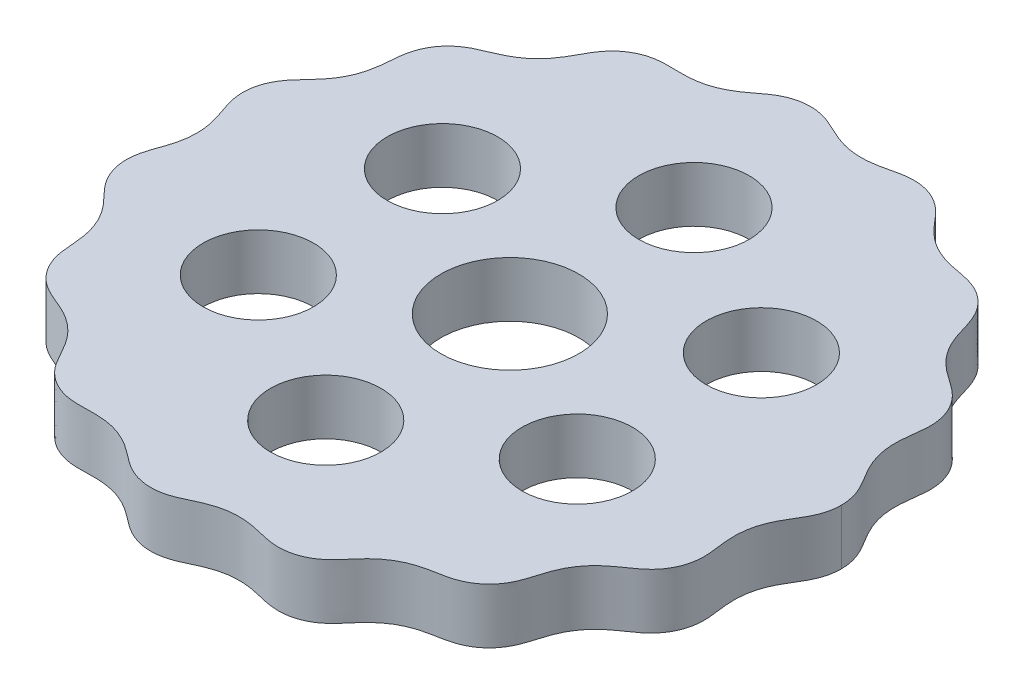
from build123d import *

# Parameters (mm, degrees)
BOSS_EXTRUDE1_DEPTH = 6
SKETCH4_R           = 7.5
SKETCH4_R_2         = 6
CUT_EXTRUDE1_DEPTH  = 52.384193919


with BuildPart() as part:
    # Sketch3 → Boss-Extrude1 (new body)
    with BuildSketch(Plane(origin=(0, 0, 0), x_dir=(1, 0, 0), z_dir=(0, 1, 0))):
        with BuildLine():
            add(Edge.make_bspline(
                [(-35, 0), (-35, -0.035819522), (-35.000616373, -0.107462841), (-35.003390054, -0.256808001), (-35.01077535, -0.421646413), (-35.021825769, -0.588219856), (-35.036504882, -0.756672424), (-35.059341773, -0.965837166), (-35.104035951, -1.290553755), (-35.185204177, -1.728353622), (-35.321111932, -2.274340703), (-35.511398877, -2.882930915), (-35.744117036, -3.541888991), (-35.999231193, -4.25800942), (-36.256031973, -5.161379022), (-36.390330129, -6.274752326), (-36.277015947, -7.512136969), (-35.868698722, -8.695231313), (-35.277300884, -9.669426211), (-34.554347705, -10.519941998), (-33.783626013, -11.298902855), (-32.985846748, -12.201646947), (-32.264584631, -13.30297659), (-31.737724515, -14.528623762), (-31.426244596, -15.845428611), (-31.299137645, -17.27258243), (-31.216127, -18.70530298), (-30.816120234, -20.100603953), (-30.073240875, -21.341751418), (-29.174351138, -22.250438515), (-28.172415899, -22.896093055), (-27.127590318, -23.355931746), (-26.10859664, -23.758738206), (-25.049780962, -24.277964858), (-23.989709649, -24.997868072), (-23.038745697, -25.922173331), (-22.234852767, -27.03288543), (-21.57001817, -28.281907032), (-20.900127092, -29.513378936), (-19.962466181, -30.574068753), (-18.795181919, -31.366318649), (-17.595631263, -31.810691732), (-16.414666993, -31.974330851), (-15.281171148, -31.958959306), (-14.203514384, -31.91747762), (-13.042151806, -31.968001953), (-11.783279681, -32.201214224), (-10.531309832, -32.66971044), (-9.48395263, -33.292502605), (-8.648334169, -33.920550223), (-7.823957174, -34.560196788), (-6.963270269, -35.155080008), (-5.844676613, -35.655024643), (-4.471519425, -35.893755086), (-3.187084678, -35.805499477), (-2.025952576, -35.461710054), (-0.992256939, -34.976213141), (-0.022683462, -34.502923006), (1.053080375, -34.087641485), (2.299584809, -33.794526859), (3.643320491, -33.722351619), (5.038534255, -33.89893647), (6.24598376, -34.2125404), (7.264354515, -34.444119372), (8.305207807, -34.543324073), (9.35208771, -34.482213909), (10.516758731, -34.167289325), (11.659268337, -33.537177777), (12.590715473, -32.709121516), (13.34098787, -31.814858509), (14.054283468, -30.982389039), (14.885038409, -30.182951686), (15.921872801, -29.431794231), (16.990420846, -28.917750141), (18.026343297, -28.602305782), (18.918007091, -28.413618025), (19.578784746, -28.293993849), (20.403759493, -28.135463838), (21.377672688, -27.861653344), (22.443971731, -27.335099919), (23.483734656, -26.460176512), (24.2541157, -25.405895772), (24.750574375, -24.262578026), (25.063904971, -23.146552345), (25.378639074, -22.114017621), (25.813131886, -21.064921211), (26.460434486, -19.960662125), (27.343829971, -18.932625358), (28.322904319, -18.143559056), (29.218225657, -17.541804862), (30.028748291, -16.97273782), (30.797058719, -16.328598531), (31.549909645, -15.413617977), (32.137977425, -14.188738612), (32.4089126, -12.90202686), (32.388985538, -11.637704019), (32.213594686, -10.474436855), (32.085323796, -9.385180269), (32.070146733, -8.410557002), (32.151917663, -7.56387468), (32.314560623, -6.756019588), (32.548800101, -5.992599911), (32.857935391, -5.266485518), (33.224571124, -4.579437291), (33.588738685, -3.973485748), (33.923596212, -3.433268023), (34.247631958, -2.87530324), (34.535248612, -2.28660009), (34.721954293, -1.781365153), (34.833464319, -1.375289499), (34.894669525, -1.087159539), (34.924762046, -0.921603412), (34.949915122, -0.755248907), (34.967564963, -0.608302523), (34.979558938, -0.483828007), (34.987456793, -0.380154151), (34.992514334, -0.294893351), (34.997257891, -0.183172559), (34.999367206, -0.089514524), (35, -0.035799586), (35, 0)],
                knots=[0.072369566, 0.072369566, 0.072369566, 0.072369566, 0.072369566, 0.073615092, 0.074860618, 0.076106145, 0.077351671, 0.078597197, 0.079842723, 0.082333775, 0.087048504, 0.091763233, 0.096477961, 0.10119269, 0.107724794, 0.114256899, 0.124215283, 0.134174364, 0.144132897, 0.150929746, 0.157726596, 0.167142542, 0.176558488, 0.186520945, 0.196481925, 0.206428247, 0.21637457, 0.228908069, 0.238866866, 0.248825964, 0.258784129, 0.266347185, 0.273910241, 0.282559119, 0.291207998, 0.301173216, 0.311644672, 0.321600071, 0.33155547, 0.343058906, 0.353017844, 0.362977018, 0.372934936, 0.380512964, 0.388090993, 0.396475019, 0.404859045, 0.41482336, 0.425823506, 0.435780105, 0.440758404, 0.445736704, 0.456709828, 0.4666684, 0.476627191, 0.48658549, 0.494428383, 0.502271277, 0.510390705, 0.518510134, 0.528474739, 0.540002591, 0.549960093, 0.559917595, 0.565389224, 0.570860853, 0.580819423, 0.590778216, 0.600736338, 0.609094586, 0.617452834, 0.625307542, 0.633162249, 0.643125841, 0.655188139, 0.660154677, 0.665121215, 0.670087753, 0.675054292, 0.685012018, 0.694970449, 0.704929277, 0.714887192, 0.723259667, 0.731632143, 0.739222078, 0.746812013, 0.756777196, 0.769365725, 0.779035556, 0.783870472, 0.788705388, 0.798661668, 0.808620831, 0.818580086, 0.828537566, 0.837174689, 0.845811813, 0.853388632, 0.860965452, 0.865947313, 0.870929173, 0.87773944, 0.884549706, 0.889251298, 0.893952891, 0.898654484, 0.903356076, 0.908334949, 0.913313821, 0.914558654, 0.915803487, 0.91704832, 0.918293153, 0.919537985, 0.920160402, 0.920782818, 0.921405235, 0.922027651, 0.923272484, 0.923272484, 0.923272484, 0.923272484, 0.923272484], degree=4))
            add(Edge.make_bspline(
                [(-35, 0), (-35, 0.035819522), (-35.000616373, 0.107462841), (-35.003390054, 0.256808001), (-35.01077535, 0.421646413), (-35.021825769, 0.588219856), (-35.036504882, 0.756672424), (-35.059341773, 0.965837166), (-35.104035951, 1.290553755), (-35.185204177, 1.728353622), (-35.321111932, 2.274340703), (-35.511398877, 2.882930915), (-35.744117036, 3.541888991), (-35.999231193, 4.25800942), (-36.256031973, 5.161379022), (-36.390330129, 6.274752326), (-36.277015947, 7.512136969), (-35.868698722, 8.695231313), (-35.277300884, 9.669426211), (-34.554347705, 10.519941998), (-33.783626013, 11.298902855), (-32.985846748, 12.201646947), (-32.264584631, 13.30297659), (-31.737724515, 14.528623762), (-31.426244596, 15.845428611), (-31.299137645, 17.27258243), (-31.216127, 18.70530298), (-30.816120234, 20.100603953), (-30.073240875, 21.341751418), (-29.174351138, 22.250438515), (-28.172415899, 22.896093055), (-27.127590318, 23.355931746), (-26.10859664, 23.758738206), (-25.049780962, 24.277964858), (-23.989709649, 24.997868072), (-23.038745697, 25.922173331), (-22.234852767, 27.03288543), (-21.57001817, 28.281907032), (-20.900127092, 29.513378936), (-19.962466181, 30.574068753), (-18.795181919, 31.366318649), (-17.595631263, 31.810691732), (-16.414666993, 31.974330851), (-15.281171148, 31.958959306), (-14.203514384, 31.91747762), (-13.042151806, 31.968001953), (-11.783279681, 32.201214224), (-10.531309831, 32.66971044), (-9.48395263, 33.292502605), (-8.648334169, 33.920550223), (-7.823957174, 34.560196788), (-6.963270269, 35.155080008), (-5.844676613, 35.655024643), (-4.471519425, 35.893755086), (-3.187084678, 35.805499476), (-2.025952576, 35.461710054), (-0.992256939, 34.976213141), (-0.022683462, 34.502923006), (1.053080375, 34.087641485), (2.299584809, 33.794526859), (3.643320491, 33.722351618), (5.038534255, 33.89893647), (6.24598376, 34.2125404), (7.264354515, 34.444119372), (8.305207807, 34.543324073), (9.35208771, 34.482213909), (10.516758731, 34.167289325), (11.659268337, 33.537177777), (12.590715473, 32.709121516), (13.34098787, 31.814858509), (14.054283468, 30.982389039), (14.885038409, 30.182951686), (15.921872801, 29.431794231), (16.990420846, 28.917750141), (18.026343297, 28.602305782), (18.918007091, 28.413618025), (19.578784746, 28.293993848), (20.403759493, 28.135463838), (21.377672688, 27.861653344), (22.443971731, 27.335099919), (23.483734656, 26.460176512), (24.2541157, 25.405895772), (24.750574375, 24.262578026), (25.063904971, 23.146552345), (25.378639074, 22.114017621), (25.813131886, 21.064921211), (26.460434486, 19.960662125), (27.343829971, 18.932625358), (28.322904319, 18.143559056), (29.218225657, 17.541804862), (30.028748291, 16.97273782), (30.797058719, 16.328598531), (31.549909645, 15.413617977), (32.137977425, 14.188738612), (32.4089126, 12.90202686), (32.388985538, 11.637704019), (32.213594686, 10.474436855), (32.085323796, 9.385180269), (32.070146733, 8.410557002), (32.151917663, 7.56387468), (32.314560623, 6.756019588), (32.548800101, 5.992599911), (32.857935391, 5.266485518), (33.224571124, 4.579437291), (33.588738685, 3.973485748), (33.923596212, 3.433268023), (34.247631958, 2.87530324), (34.535248612, 2.28660009), (34.721954293, 1.781365153), (34.833464319, 1.375289499), (34.894669525, 1.087159539), (34.924762046, 0.921603411), (34.949915122, 0.755248907), (34.967564963, 0.608302523), (34.979558938, 0.483828007), (34.987456793, 0.380154151), (34.992514334, 0.294893351), (34.997257891, 0.183172559), (34.999367206, 0.089514524), (35, 0.035799586), (35, 0)],
                knots=[0.072369566, 0.072369566, 0.072369566, 0.072369566, 0.072369566, 0.073615092, 0.074860618, 0.076106145, 0.077351671, 0.078597197, 0.079842723, 0.082333775, 0.087048504, 0.091763233, 0.096477961, 0.10119269, 0.107724794, 0.114256899, 0.124215283, 0.134174364, 0.144132897, 0.150929746, 0.157726596, 0.167142542, 0.176558488, 0.186520945, 0.196481925, 0.206428247, 0.21637457, 0.228908069, 0.238866866, 0.248825964, 0.258784129, 0.266347185, 0.273910241, 0.282559119, 0.291207998, 0.301173216, 0.311644672, 0.321600071, 0.33155547, 0.343058906, 0.353017844, 0.362977018, 0.372934936, 0.380512964, 0.388090993, 0.396475019, 0.404859045, 0.41482336, 0.425823506, 0.435780105, 0.440758404, 0.445736704, 0.456709828, 0.4666684, 0.476627191, 0.48658549, 0.494428383, 0.502271277, 0.510390705, 0.518510134, 0.528474739, 0.540002591, 0.549960093, 0.559917595, 0.565389224, 0.570860853, 0.580819423, 0.590778216, 0.600736338, 0.609094586, 0.617452834, 0.625307542, 0.633162249, 0.643125841, 0.655188139, 0.660154677, 0.665121215, 0.670087753, 0.675054292, 0.685012018, 0.694970449, 0.704929277, 0.714887192, 0.723259667, 0.731632143, 0.739222078, 0.746812013, 0.756777196, 0.769365725, 0.779035556, 0.783870472, 0.788705388, 0.798661668, 0.808620831, 0.818580086, 0.828537566, 0.837174689, 0.845811813, 0.853388632, 0.860965452, 0.865947313, 0.870929173, 0.87773944, 0.884549706, 0.889251298, 0.893952891, 0.898654484, 0.903356076, 0.908334949, 0.913313821, 0.914558654, 0.915803487, 0.91704832, 0.918293153, 0.919537985, 0.920160402, 0.920782818, 0.921405235, 0.922027651, 0.923272484, 0.923272484, 0.923272484, 0.923272484, 0.923272484], degree=4))
        make_face()
    extrude(amount=BOSS_EXTRUDE1_DEPTH)

    # Sketch4 → Cut-Extrude1 (cut, through all)
    with BuildSketch(Plane(origin=(0, 6, 0), x_dir=(1, 0, 0), z_dir=(0, 1, 0))):
        with Locations(Location((-1, 0, 0), (0, 0, 270))):
            Circle(SKETCH4_R)
        with Locations(Location((-1, 20, 0), (0, 0, 270))):
            Circle(SKETCH4_R_2)
        with Locations(Location((16.320508076, 10, 0), (0, 0, 270))):
            Circle(SKETCH4_R_2)
        with Locations(Location((16.320508076, -10, 0), (0, 0, 270))):
            Circle(SKETCH4_R_2)
        with Locations(Location((-1, -20, 0), (0, 0, 270))):
            Circle(SKETCH4_R_2)
        with Locations(Location((-18.320508076, -10, 0), (0, 0, 270))):
            Circle(SKETCH4_R_2)
        with Locations(Location((-18.320508076, 10, 0), (0, 0, 270))):
            Circle(SKETCH4_R_2)
    extrude(amount=-CUT_EXTRUDE1_DEPTH, mode=Mode.SUBTRACT)


solid = part.part
